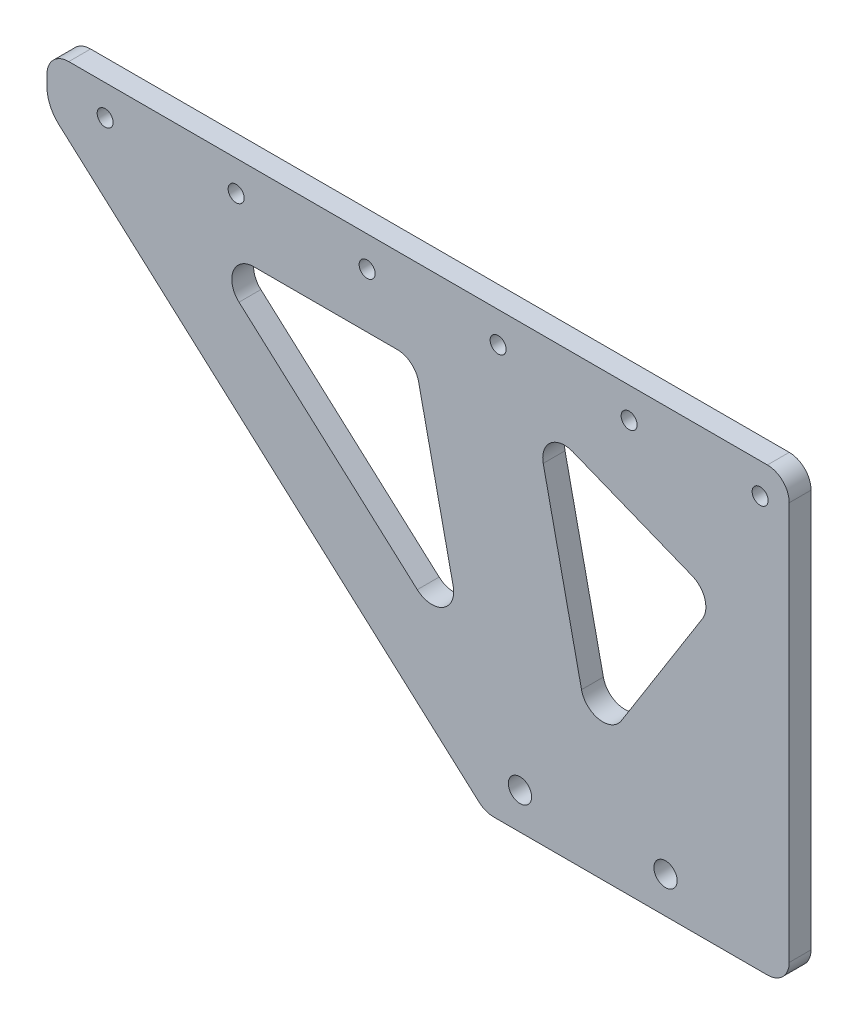
from build123d import *

# Parameters (mm, degrees)
EXTRUDE_1_DEPTH     = 3
SKETCH_2_R          = 1.1
SKETCH_2_R_2        = 1.025013192
SKETCH_2_R_3        = 1.6
CUT_EXTRUDE_2_DEPTH = 116.143388868
FILLET_1_R          = 5
SKETCH_3_R          = 1.6
SKETCH_3_R_2        = 1.1
EXTRUDE_2_DEPTH     = 3
CUT_EXTRUDE_3_DEPTH = 10
FILLET_2_R          = 3
EXTRUDE_3_DEPTH     = 3
SKETCH_6_W          = 3
SKETCH_6_H          = 59
EXTRUDE_4_DEPTH     = 2
SKETCH_7_W          = 102
SKETCH_7_H          = 3
EXTRUDE_5_DEPTH     = 1.7
FILLET_4_R          = 3


with BuildPart() as part:
    # 草图1 → 凸台-拉伸1 (new body)
    with BuildSketch(Plane.XY):
        Polygon((0, 0), (0, -57), (-42, -57), (-100, -5), (-100, 0), align=None)
    extrude(amount=EXTRUDE_1_DEPTH)

    # 草图2 → 切除-拉伸2 (cut, through all)
    with BuildSketch(Plane.XY.offset(3)):
        with Locations(Location((-38, -45, 0), (0, 0, 180))):
            Circle(SKETCH_2_R)
        with Locations(Location((-38, -14.5, 0), (0, 0, 180))):
            Circle(SKETCH_2_R)
        with Locations(Location((-38, -2.5, 0), (0, 0, 180))):
            Circle(SKETCH_2_R)
        with Locations(Location((-56, -2.5, 0), (0, 0, 180))):
            Circle(SKETCH_2_R)
        with Locations(Location((-74, -2.5, 0), (0, 0, 180))):
            Circle(SKETCH_2_R)
        with Locations(Location((-92, -2.5, 0), (0, 0, 180))):
            Circle(SKETCH_2_R)
        with Locations((-55.007781707, -42.651734732)):
            Circle(SKETCH_2_R_2)
        with Locations((-81.223203164, -24.300939713)):
            Circle(SKETCH_2_R_2)
        with Locations((-20, -2.5)):
            Circle(SKETCH_2_R)
        with Locations((-2, -2.5)):
            Circle(SKETCH_2_R)
        with Locations((-2, -14.5)):
            Circle(SKETCH_2_R)
        with Locations((-2, -45)):
            Circle(SKETCH_2_R)
        with Locations((-15, -54)):
            Circle(SKETCH_2_R_3)
        with Locations((-35, -54)):
            Circle(SKETCH_2_R_3)
    extrude(amount=-CUT_EXTRUDE_2_DEPTH, mode=Mode.SUBTRACT)

    # 圆角1
    fillet_1_edges = [part.edges().sort_by_distance(p)[0] for p in [
        (-100, -5, 1.5),
    ]]
    fillet(fillet_1_edges, radius=FILLET_1_R)

    # 草图3 → 凸台-拉伸2 (add)
    with BuildSketch(Plane.XY.offset(3)):
        with BuildLine():
            Line((-100, 0), (-100, -2.767468243))
            ThreePointArc((-100, -2.767468243), (-99.565557216, -4.806018538), (-98.337725079, -6.490315447))
            Line((-98.337725079, -6.490315447), (-42, -57))
            Line((-42, -57), (0, -57))
            Line((0, -57), (0, 0))
            Line((0, 0), (-100, 0))
        make_face()
        with Locations((-15, -54)):
            Circle(SKETCH_3_R, mode=Mode.SUBTRACT)
        with Locations((-35, -54)):
            Circle(SKETCH_3_R, mode=Mode.SUBTRACT)
        with Locations((-2, -2.5)):
            Circle(SKETCH_3_R_2, mode=Mode.SUBTRACT)
        with Locations((-20, -2.5)):
            Circle(SKETCH_3_R_2, mode=Mode.SUBTRACT)
        with Locations(Location((-38, -2.5, 0), (0, 0, 180))):
            Circle(SKETCH_3_R_2, mode=Mode.SUBTRACT)
        with Locations(Location((-56, -2.5, 0), (0, 0, 180))):
            Circle(SKETCH_3_R_2, mode=Mode.SUBTRACT)
        with Locations(Location((-74, -2.5, 0), (0, 0, 180))):
            Circle(SKETCH_3_R_2, mode=Mode.SUBTRACT)
        with Locations(Location((-92, -2.5, 0), (0, 0, 180))):
            Circle(SKETCH_3_R_2, mode=Mode.SUBTRACT)
    extrude(amount=-EXTRUDE_2_DEPTH)

    # 草图4 → 切除-拉伸3 (cut)
    with BuildSketch(Plane.XY.offset(3)):
        Polygon((-79.442813774, -10), (-42.214341741, -43.377250788), (-49.442813774, -10), align=None)
        Polygon((-33, -8), (-8, -18), (-24.986953422, -45), align=None)
    extrude(amount=-CUT_EXTRUDE_3_DEPTH, mode=Mode.SUBTRACT)

    # 圆角2
    fillet_2_edges = [part.edges().sort_by_distance(p)[0] for p in [
        (-79.442813774, -10, 1.5),
        (-49.442813774, -10, 1.5),
        (-42.214341741, -43.377250788, 1.5),
        (-24.986953422, -45, 1.5),
        (-33, -8, 1.5),
        (-8, -18, 1.5),
    ]]
    fillet(fillet_2_edges, radius=FILLET_2_R)

    # 草图5 → 凸台-拉伸3 (add)
    with BuildSketch(Plane.XY.offset(3)):
        Polygon((0, -57), (-42, -57), (-39.769230769, -59), (0, -59), align=None)
    extrude(amount=-EXTRUDE_3_DEPTH)

    # 草图6 → 凸台-拉伸4 (add)
    with BuildSketch(Plane(origin=(0, 0, 0), x_dir=(0, 0, -1), z_dir=(1, 0, 0))):
        with Locations((-1.5, -29.5)):
            Rectangle(SKETCH_6_W, SKETCH_6_H)
    extrude(amount=EXTRUDE_4_DEPTH)

    # 草图7 → 凸台-拉伸5 (add)
    with BuildSketch(Plane(origin=(0, 0, 0), x_dir=(1, 0, 0), z_dir=(0, 1, 0))):
        with Locations((-49, -1.5)):
            Rectangle(SKETCH_7_W, SKETCH_7_H)
    extrude(amount=EXTRUDE_5_DEPTH)

    # 圆角4
    fillet_4_edges = [part.edges().sort_by_distance(p)[0] for p in [
        (-39.769230769, -59, 1.5),
        (2, -59, 1.5),
        (2, 1.7, 1.5),
        (-100, 1.7, 1.5),
    ]]
    fillet(fillet_4_edges, radius=FILLET_4_R)


solid = part.part
